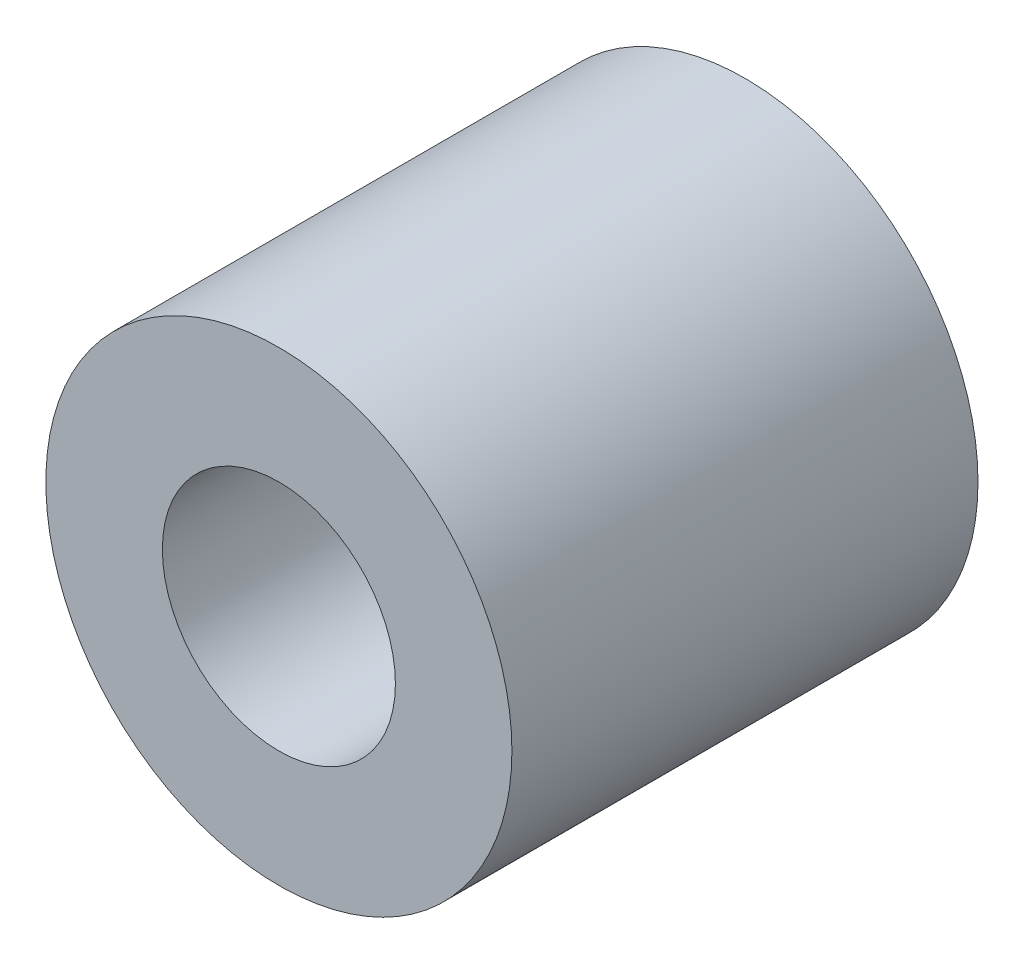
from build123d import *

# Parameters (mm, degrees)
SKETCH1_R           = 6.35
SKETCH1_R_2         = 3.175
BOSS_EXTRUDE1_DEPTH = 6.35


with BuildPart() as part:
    # Sketch1 → Boss-Extrude1 (new, symmetric)
    with BuildSketch(Plane.XY):
        Circle(SKETCH1_R)
        Circle(SKETCH1_R_2, mode=Mode.SUBTRACT)
    extrude(amount=BOSS_EXTRUDE1_DEPTH, both=True)


solid = part.part
